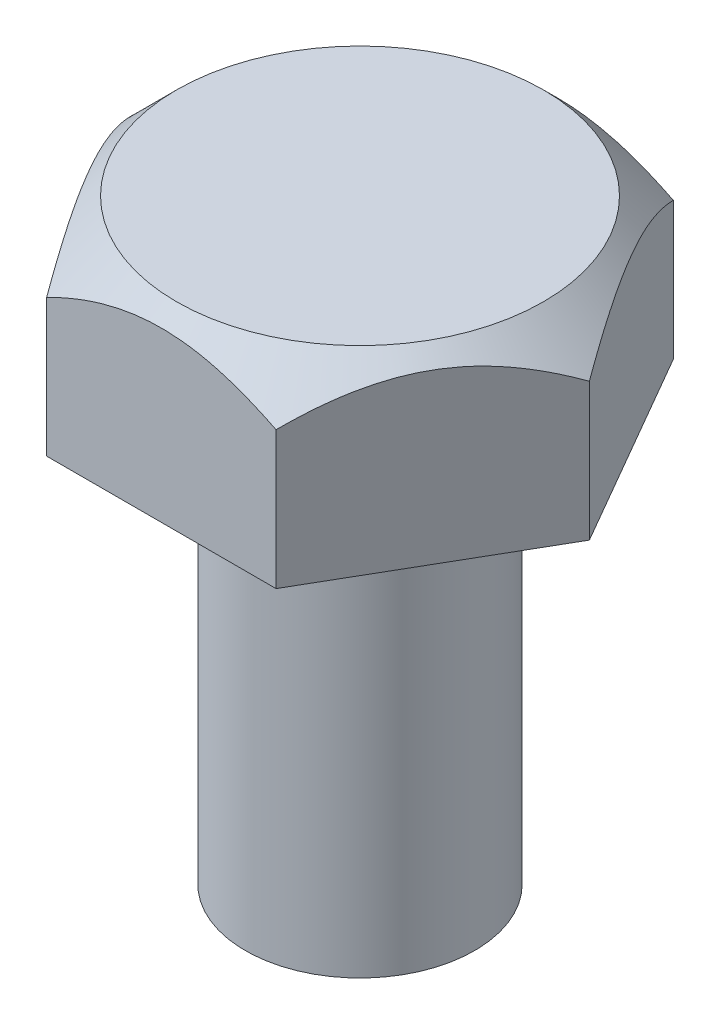
from build123d import *

# Parameters (mm, degrees)
SKETCH1_R           = 2.5
BOSS_EXTRUDE1_DEPTH = 13
BOSS_EXTRUDE2_DEPTH = 4


with BuildPart() as part:
    # Sketch1 → Boss-Extrude1 (new body)
    with BuildSketch(Plane(origin=(0, 0, 0), x_dir=(1, 0, 0), z_dir=(0, 1, 0))):
        with Locations(Location((0, 0, 0), (0, 0, 90))):
            Circle(SKETCH1_R)
    extrude(amount=BOSS_EXTRUDE1_DEPTH)

    # Sketch2 → Boss-Extrude2 (add)
    with BuildSketch(Plane(origin=(0, 13, 0), x_dir=(1, 0, 0), z_dir=(0, 1, 0))):
        Polygon((5, 0), (2.5, 4.330127019), (-2.5, 4.330127019), (-5, 0), (-2.5, -4.330127019), (2.5, -4.330127019), align=None)
    extrude(amount=-BOSS_EXTRUDE2_DEPTH)

    # Sketch3 → Cut-Revolve1 (revolve, cut)
    with BuildSketch(Plane.XY, mode=Mode.PRIVATE) as cut_revolve1_sk:
        Polygon((4, 13), (5, 12), (5, 13), align=None)
    revolve(cut_revolve1_sk.sketch.rotate(Axis((0, 0, 0), (0, 1, 0)), 90), axis=Axis((0, 0, 0), (0, 1, 0)), mode=Mode.SUBTRACT)


solid = part.part
